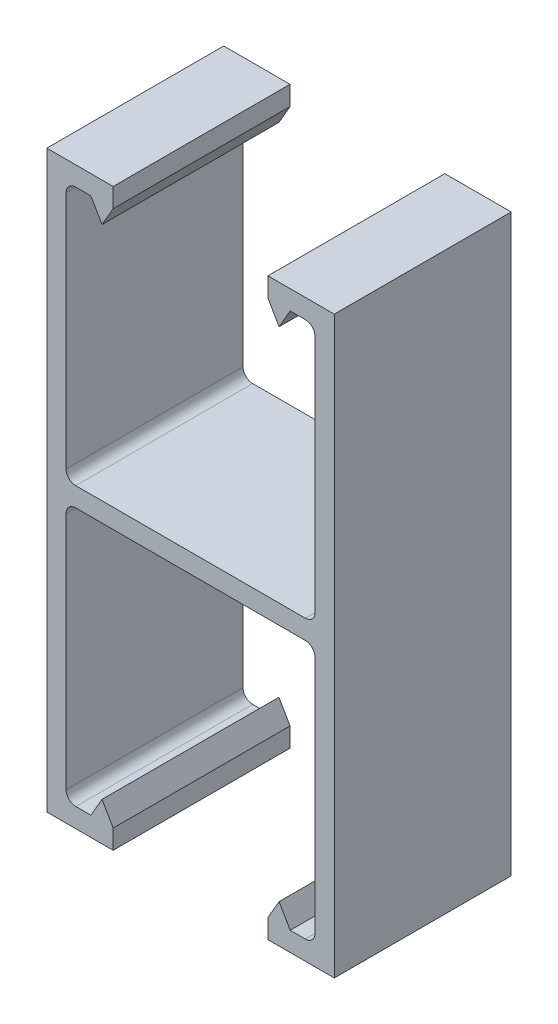
from build123d import *

# Parameters (mm, degrees)
BASE_EXTRUDE_DEPTH = 12.7


with BuildPart() as part:
    # Sketch1 → Base-Extrude (new, symmetric)
    with BuildSketch(Plane.XY):
        with BuildLine():
            Line((-11.1125, 41.275), (-20.6375, 41.275))
            Line((-20.6375, 41.275), (-20.6375, -41.275))
            Line((-20.6375, -41.275), (-11.1125, -41.275))
            Line((-11.1125, -41.275), (-11.1125, -38.5064))
            Line((-11.1125, -38.5064), (-12.710951958, -35.7378))
            Line((-12.710951958, -35.7378), (-14.309403911, -38.5064))
            Line((-14.309403911, -38.5064), (-16.4846, -38.5064))
            ThreePointArc((-16.4846, -38.5064), (-17.463447917, -38.100947917), (-17.8689, -37.1221))
            Line((-17.8689, -37.1221), (-17.8689, -2.7686))
            ThreePointArc((-17.8689, -2.7686), (-17.463447917, -1.789752083), (-16.4846, -1.3843))
            Line((-16.4846, -1.3843), (16.4846, -1.3843))
            ThreePointArc((16.4846, -1.3843), (17.463447917, -1.789752083), (17.8689, -2.7686))
            Line((17.8689, -2.7686), (17.8689, -37.1221))
            ThreePointArc((17.8689, -37.1221), (17.463447917, -38.100947917), (16.4846, -38.5064))
            Line((16.4846, -38.5064), (14.309403911, -38.5064))
            Line((14.309403911, -38.5064), (12.710951958, -35.7378))
            Line((12.710951958, -35.7378), (11.1125, -38.5064))
            Line((11.1125, -38.5064), (11.1125, -41.275))
            Line((11.1125, -41.275), (20.6375, -41.275))
            Line((20.6375, -41.275), (20.6375, 41.275))
            Line((20.6375, 41.275), (11.1125, 41.275))
            Line((11.1125, 41.275), (11.1125, 38.5064))
            Line((11.1125, 38.5064), (12.710951958, 35.7378))
            Line((12.710951958, 35.7378), (14.309403911, 38.5064))
            Line((14.309403911, 38.5064), (16.4846, 38.5064))
            ThreePointArc((16.4846, 38.5064), (17.463447917, 38.100947917), (17.8689, 37.1221))
            Line((17.8689, 37.1221), (17.8689, 2.7686))
            ThreePointArc((17.8689, 2.7686), (17.463447917, 1.789752083), (16.4846, 1.3843))
            Line((16.4846, 1.3843), (-16.4846, 1.3843))
            ThreePointArc((-16.4846, 1.3843), (-17.463447917, 1.789752083), (-17.8689, 2.7686))
            Line((-17.8689, 2.7686), (-17.8689, 37.1221))
            ThreePointArc((-17.8689, 37.1221), (-17.463447917, 38.100947917), (-16.4846, 38.5064))
            Line((-16.4846, 38.5064), (-14.309403911, 38.5064))
            Line((-14.309403911, 38.5064), (-12.710951958, 35.7378))
            Line((-12.710951958, 35.7378), (-11.1125, 38.5064))
            Line((-11.1125, 38.5064), (-11.1125, 41.275))
        make_face()
    extrude(amount=BASE_EXTRUDE_DEPTH, both=True)


solid = part.part
